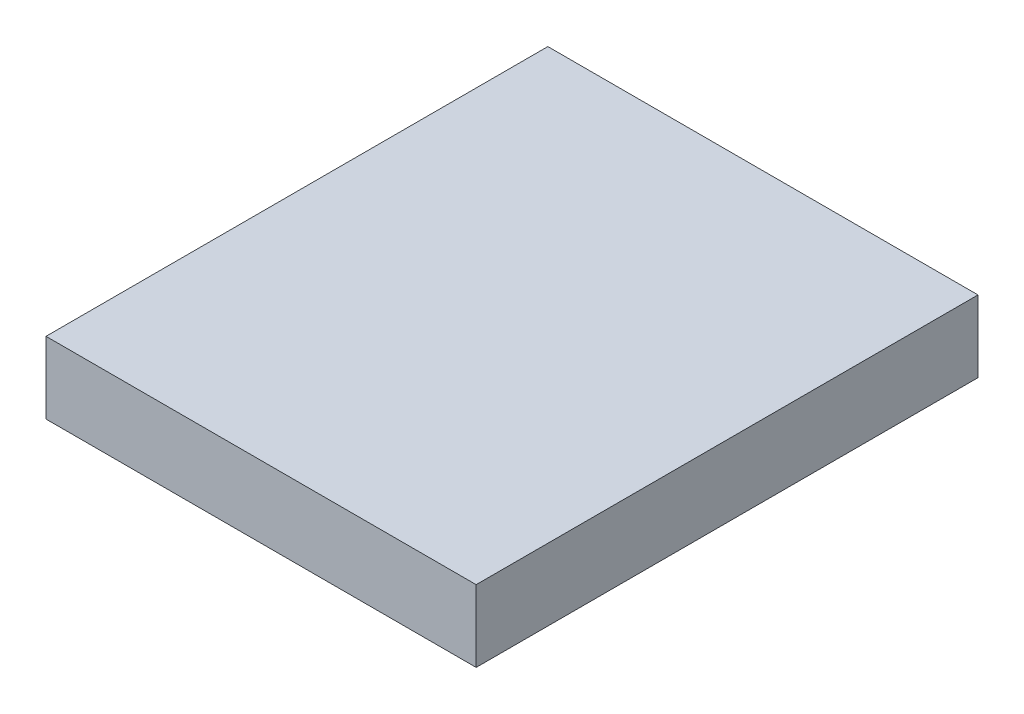
from build123d import *

# Parameters (mm, degrees)
SKETCH1_W           = 457.2
SKETCH1_H           = 533.4
BOSS_EXTRUDE1_DEPTH = 76.2


with BuildPart() as part:
    # Sketch1 → Boss-Extrude1 (new body)
    with BuildSketch(Plane(origin=(0, 0, 0), x_dir=(1, 0, 0), z_dir=(0, 1, 0))):
        Rectangle(SKETCH1_W, SKETCH1_H)
    extrude(amount=BOSS_EXTRUDE1_DEPTH)


solid = part.part
